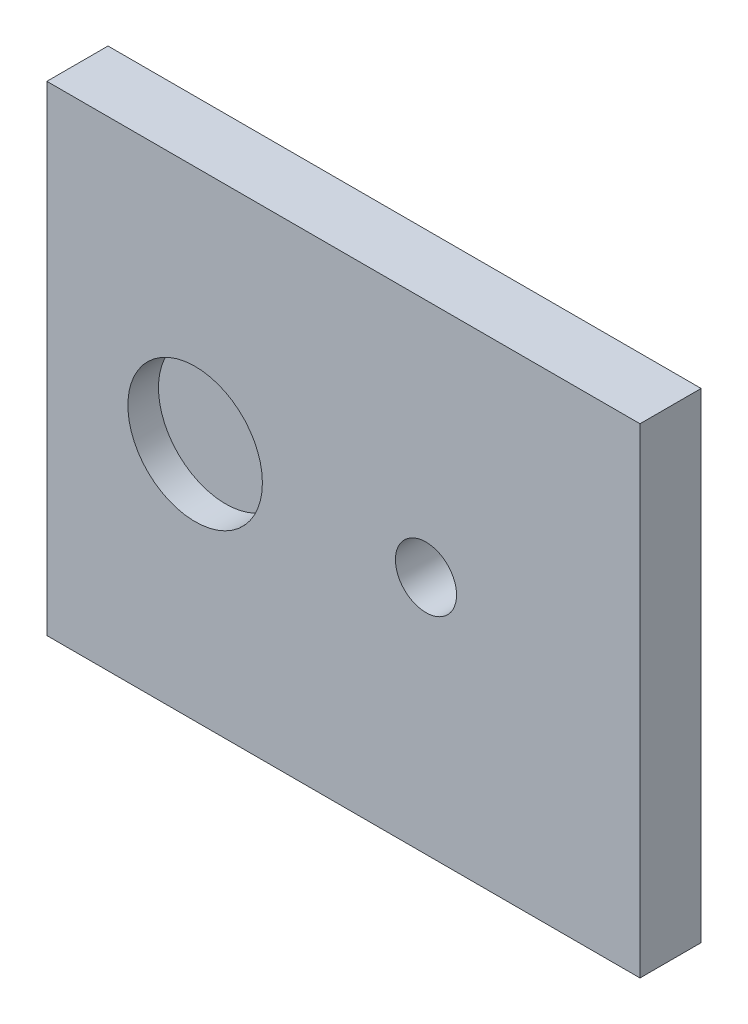
from build123d import *

# Parameters (mm, degrees)
SKETCH1_W           = 97
SKETCH1_H           = 78.5
BOSS_EXTRUDE1_DEPTH = 10
CUT_EXTRUDE1_REACH  = 65.189
SKETCH2_R           = 5
SKETCH3_R           = 11
CUT_EXTRUDE2_DEPTH  = 5


with BuildPart() as part:
    # Sketch1 → Boss-Extrude1 (new body)
    with BuildSketch(Plane.XY):
        Rectangle(SKETCH1_W, SKETCH1_H)
    extrude(amount=BOSS_EXTRUDE1_DEPTH)

    # Sketch2 → Cut-Extrude1 (cut, up to next)
    with BuildSketch(Plane.XY.offset(10), mode=Mode.PRIVATE) as cut_extrude1_sk1:
        with Locations((13.5, 0)):
            Circle(SKETCH2_R)
    cut_extrude1_tool1 = extrude(cut_extrude1_sk1.sketch, amount=-CUT_EXTRUDE1_REACH, mode=Mode.PRIVATE) & part.part
    add(cut_extrude1_tool1.solids().sort_by_distance((13.5, 0, 10))[0], mode=Mode.SUBTRACT)

    # Sketch3 → Cut-Extrude2 (cut)
    with BuildSketch(Plane.XY.offset(10)):
        with Locations((-24.25, 0)):
            Circle(SKETCH3_R)
    extrude(amount=-CUT_EXTRUDE2_DEPTH, mode=Mode.SUBTRACT)


solid = part.part
